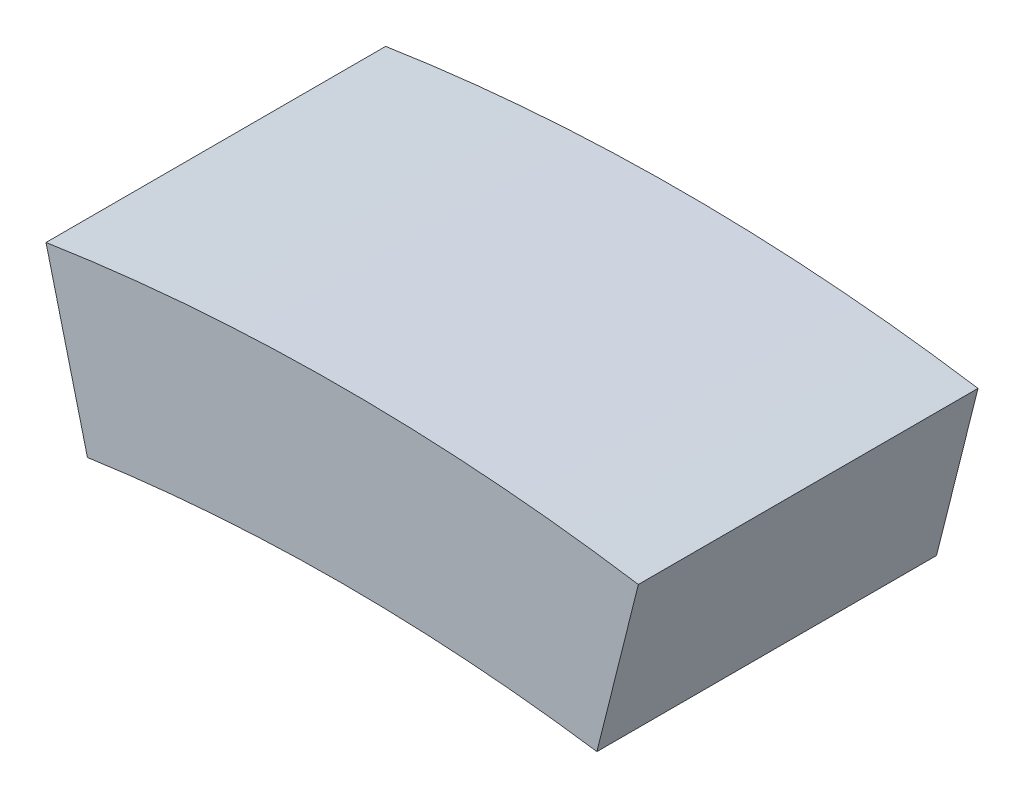
from build123d import *

# Parameters (mm, degrees)
BOSS_EXTRUDE1_DEPTH = 10


with BuildPart() as part:
    # Sketch3 → Boss-Extrude1 (new, symmetric)
    with BuildSketch(Plane.XY):
        with BuildLine():
            Line((0, 0), (-2.440921314, 9.745803444))
            ThreePointArc((-2.440921314, 9.745803444), (15, 11.084007957), (32.440921314, 9.745803444))
            Line((32.440921314, 9.745803444), (30, 0))
            ThreePointArc((30, 0), (15, 1.084007957), (0, 0))
        make_face()
    extrude(amount=BOSS_EXTRUDE1_DEPTH, both=True)


solid = part.part
